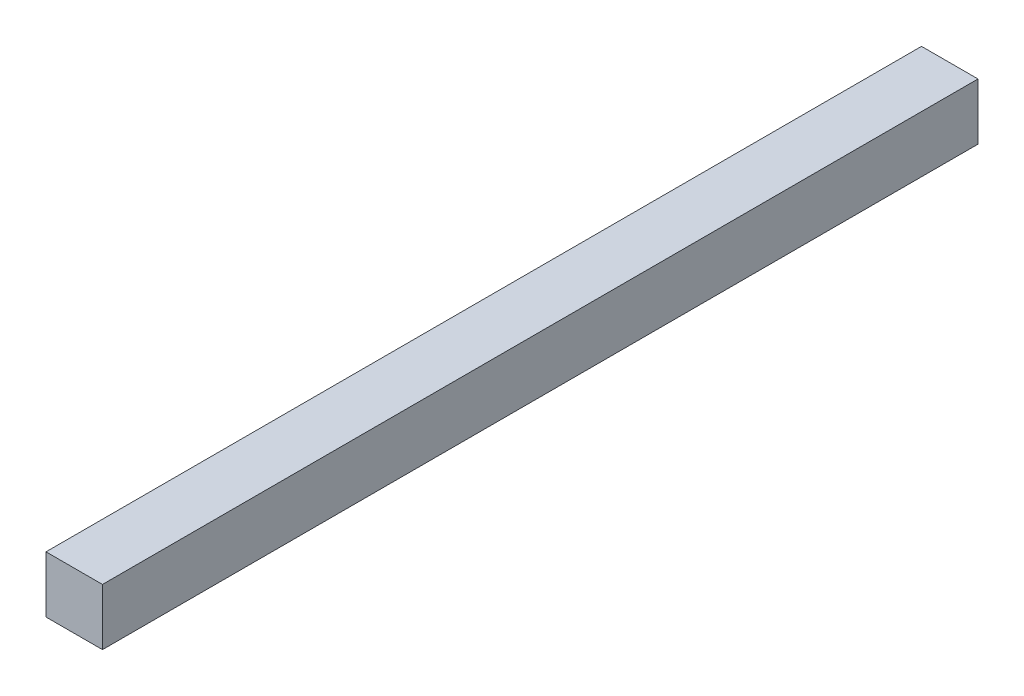
from build123d import *

# Parameters (mm, degrees)
ESQUISSE1_W        = 40
ESQUISSE1_H        = 40
BOSS_EXTRU_1_DEPTH = 620


with BuildPart() as part:
    # Esquisse1 → Boss.-Extru.1 (new body)
    with BuildSketch(Plane.XY):
        with Locations((20, 20)):
            Rectangle(ESQUISSE1_W, ESQUISSE1_H)
    extrude(amount=BOSS_EXTRU_1_DEPTH)


solid = part.part
